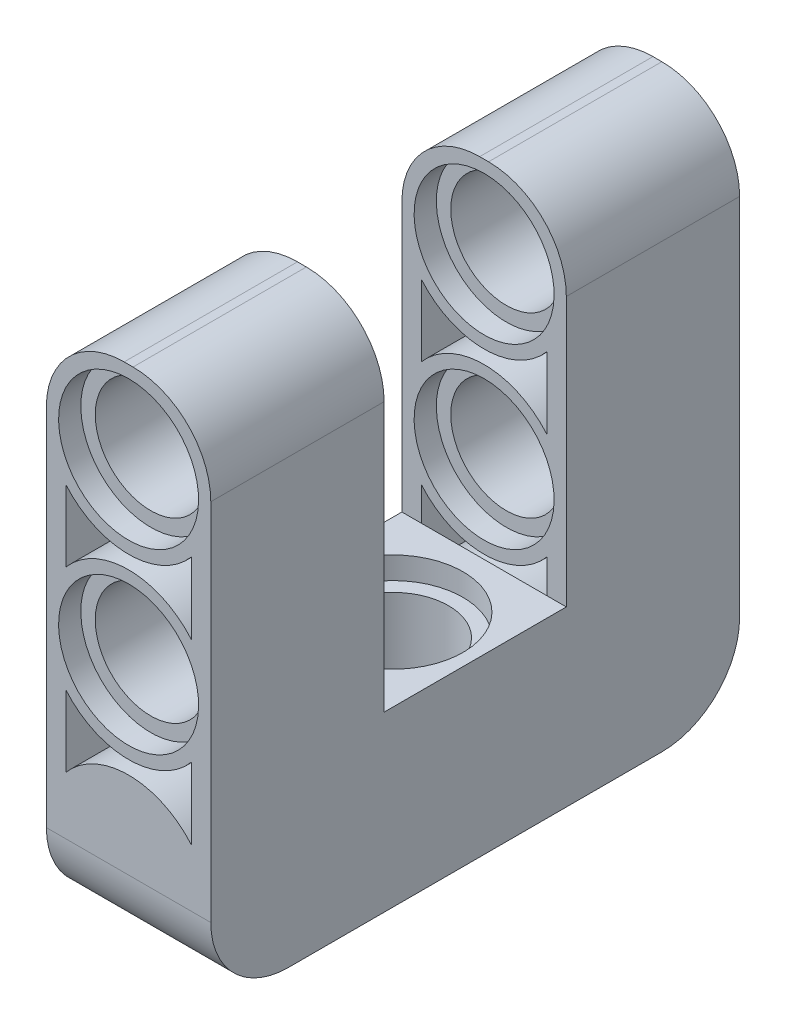
from build123d import *

# Parameters (mm, degrees)
SKETCH_3_W             = 7.8
SKETCH_3_H             = 23.4
SKETCH_3_W_2           = 8
SKETCH_3_H_2           = 7.8
SKETCH_3_W_3           = 0.1
EXTRUDE_1_DEPTH        = 7.4
CUT_EXTRUDE_1_REACH    = 22.97
SKETCH_4_R             = 2.5
SKETCH_4_3_R           = 3.15
SKETCH_4_3_R_2         = 2.5
CUT_EXTRUDE_2_DEPTH    = 1
CUT_EXTRUDE_START      = -6.8
SKETCH_4_4_R           = 3.15
SKETCH_4_4_R_2         = 2.5
CUT_EXTRUDE_3_DEPTH    = 1
SKETCH_5_R             = 2.5
CUT_EXTRUDE_4_DEPTH    = 35.187132082
SKETCH_5_3_R           = 3.15
SKETCH_5_3_R_2         = 2.5
CUT_EXTRUDE_5_DEPTH    = 1
SKETCH_5_4_R           = 3.15
SKETCH_5_4_R_2         = 2.5
CUT_EXTRUDE_6_DEPTH    = 1
CUT_EXTRUDE_START_2    = -16
SKETCH_5_5_R           = 3.15
SKETCH_5_5_R_2         = 2.5
CUT_EXTRUDE_7_DEPTH    = 1
CUT_EXTRUDE_START_3    = -22.8
SKETCH_5_6_R           = 3.15
SKETCH_5_6_R_2         = 2.5
CUT_EXTRUDE_8_DEPTH    = 1
PATTERN_LINEAR_1_COUNT = 2
PATTERN_LINEAR_1_PITCH = 8
CUT_EXTRUDE_9_DEPTH    = 2
CUT_EXTRUDE_START_4    = -5.8
CUT_EXTRUDE_10_DEPTH   = 2
CUT_EXTRUDE_11_DEPTH   = 2
CUT_EXTRUDE_START_5    = -21.8
CUT_EXTRUDE_12_DEPTH   = 2
PATTERN_LINEAR_2_COUNT = 2
PATTERN_LINEAR_2_PITCH = 8
FILLET_1_R             = 3.5


with BuildPart() as part:
    # 草图3 → 凸台-拉伸1 (new body)
    with BuildSketch(Plane(origin=(0, 0, 0), x_dir=(0, 0, -1), z_dir=(1, 0, 0))):
        with Locations((-8, 11.7)):
            Rectangle(SKETCH_3_W, SKETCH_3_H)
        with Locations((8, 11.7)):
            Rectangle(SKETCH_3_W, SKETCH_3_H)
        with Locations((0, 3.9)):
            Rectangle(SKETCH_3_W_2, SKETCH_3_H_2)
        with Locations((-4.05, 3.9)):
            Rectangle(SKETCH_3_W_3, SKETCH_3_H_2)
        with Locations((4.05, 3.9)):
            Rectangle(SKETCH_3_W_3, SKETCH_3_H_2)
    extrude(amount=EXTRUDE_1_DEPTH)

    # 草图4 → 切除-拉伸1 (cut, up to next)
    with BuildSketch(Plane(origin=(0, 7.8, 0), x_dir=(1, 0, 0), z_dir=(0, 1, 0)), mode=Mode.PRIVATE) as cut_extrude_1_sk1:
        with Locations(Location((3.7, 0, 0), (0, 0, 270))):
            Circle(SKETCH_4_R)
    cut_extrude_1_tool1 = extrude(cut_extrude_1_sk1.sketch, amount=-CUT_EXTRUDE_1_REACH, mode=Mode.PRIVATE) & part.part
    add(cut_extrude_1_tool1.solids().sort_by_distance((3.7, 7.8, 0))[0], mode=Mode.SUBTRACT)

    # 草图4<3> → 切除-拉伸2 (cut)
    with BuildSketch(Plane(origin=(0, 7.8, 0), x_dir=(1, 0, 0), z_dir=(0, 1, 0))):
        with Locations(Location((3.7, 0, 0), (0, 0, 270))):
            Circle(SKETCH_4_3_R)
        with Locations(Location((3.7, 0, 0), (0, 0, 270))):
            Circle(SKETCH_4_3_R_2, mode=Mode.SUBTRACT)
    extrude(amount=-CUT_EXTRUDE_2_DEPTH, mode=Mode.SUBTRACT)

    # 草图4<4> → 切除-拉伸3 (cut)
    with BuildSketch(Plane(origin=(0, 7.8, 0), x_dir=(1, 0, 0), z_dir=(0, 1, 0)).offset(CUT_EXTRUDE_START)):
        with Locations(Location((3.7, 0, 0), (0, 0, 270))):
            Circle(SKETCH_4_4_R)
        with Locations(Location((3.7, 0, 0), (0, 0, 270))):
            Circle(SKETCH_4_4_R_2, mode=Mode.SUBTRACT)
    extrude(amount=-CUT_EXTRUDE_3_DEPTH, mode=Mode.SUBTRACT)

    # 草图5 → 切除-拉伸4 (cut, through all)
    with BuildSketch(Plane(origin=(0, 0, -11.9), x_dir=(-1, 0, 0), z_dir=(0, 0, -1))):
        with Locations((-3.7, 11.7)):
            Circle(SKETCH_5_R)
    cut_extrude_4 = extrude(amount=-CUT_EXTRUDE_4_DEPTH, mode=Mode.SUBTRACT)

    # 草图5<3> → 切除-拉伸5 (cut)
    with BuildSketch(Plane(origin=(0, 0, -11.9), x_dir=(-1, 0, 0), z_dir=(0, 0, -1))):
        with Locations((-3.7, 11.7)):
            Circle(SKETCH_5_3_R)
        with Locations((-3.7, 11.7)):
            Circle(SKETCH_5_3_R_2, mode=Mode.SUBTRACT)
    cut_extrude_5 = extrude(amount=-CUT_EXTRUDE_5_DEPTH, mode=Mode.SUBTRACT)

    # 草图5<4> → 切除-拉伸6 (cut)
    with BuildSketch(Plane(origin=(0, 0, -11.9), x_dir=(-1, 0, 0), z_dir=(0, 0, -1)).offset(CUT_EXTRUDE_START)):
        with Locations((-3.7, 11.7)):
            Circle(SKETCH_5_4_R)
        with Locations((-3.7, 11.7)):
            Circle(SKETCH_5_4_R_2, mode=Mode.SUBTRACT)
    cut_extrude_6 = extrude(amount=-CUT_EXTRUDE_6_DEPTH, mode=Mode.SUBTRACT)

    # 草图5<5> → 切除-拉伸7 (cut)
    with BuildSketch(Plane(origin=(0, 0, -11.9), x_dir=(-1, 0, 0), z_dir=(0, 0, -1)).offset(CUT_EXTRUDE_START_2)):
        with Locations((-3.7, 11.7)):
            Circle(SKETCH_5_5_R)
        with Locations((-3.7, 11.7)):
            Circle(SKETCH_5_5_R_2, mode=Mode.SUBTRACT)
    cut_extrude_7 = extrude(amount=-CUT_EXTRUDE_7_DEPTH, mode=Mode.SUBTRACT)

    # 草图5<6> → 切除-拉伸8 (cut)
    with BuildSketch(Plane(origin=(0, 0, -11.9), x_dir=(-1, 0, 0), z_dir=(0, 0, -1)).offset(CUT_EXTRUDE_START_3)):
        with Locations((-3.7, 11.7)):
            Circle(SKETCH_5_6_R)
        with Locations((-3.7, 11.7)):
            Circle(SKETCH_5_6_R_2, mode=Mode.SUBTRACT)
    cut_extrude_8 = extrude(amount=-CUT_EXTRUDE_8_DEPTH, mode=Mode.SUBTRACT)

    # 阵列(线性)1: 切除-拉伸4, 切除-拉伸5, 切除-拉伸6, 切除-拉伸7, 切除-拉伸8 ×2
    with Locations(*[(0, i * PATTERN_LINEAR_1_PITCH, 0) for i in range(1, PATTERN_LINEAR_1_COUNT)]):
        add(cut_extrude_4, mode=Mode.SUBTRACT)
        add(cut_extrude_5, mode=Mode.SUBTRACT)
        add(cut_extrude_6, mode=Mode.SUBTRACT)
        add(cut_extrude_7, mode=Mode.SUBTRACT)
        add(cut_extrude_8, mode=Mode.SUBTRACT)

    # 草图6 → 切除-拉伸9 (cut)
    with BuildSketch(Plane(origin=(0, 0, -11.9), x_dir=(-1, 0, 0), z_dir=(0, 0, -1))):
        with BuildLine():
            ThreePointArc((-6.525, 14.089429848), (-3.7, 15.4), (-0.875, 14.089429848))
            Line((-0.875, 14.089429848), (-0.875, 17.310570152))
            ThreePointArc((-0.875, 17.310570152), (-3.7, 16), (-6.525, 17.310570152))
            Line((-6.525, 17.310570152), (-6.525, 14.089429848))
        make_face()
    cut_extrude_9 = extrude(amount=-CUT_EXTRUDE_9_DEPTH, mode=Mode.SUBTRACT)

    # 草图6<3> → 切除-拉伸10 (cut)
    with BuildSketch(Plane(origin=(0, 0, -11.9), x_dir=(-1, 0, 0), z_dir=(0, 0, -1)).offset(CUT_EXTRUDE_START_4)):
        with BuildLine():
            ThreePointArc((-6.525, 14.089429848), (-3.7, 15.4), (-0.875, 14.089429848))
            Line((-0.875, 14.089429848), (-0.875, 17.310570152))
            ThreePointArc((-0.875, 17.310570152), (-3.7, 16), (-6.525, 17.310570152))
            Line((-6.525, 17.310570152), (-6.525, 14.089429848))
        make_face()
    cut_extrude_10 = extrude(amount=-CUT_EXTRUDE_10_DEPTH, mode=Mode.SUBTRACT)

    # 草图6<4> → 切除-拉伸11 (cut)
    with BuildSketch(Plane(origin=(0, 0, -11.9), x_dir=(-1, 0, 0), z_dir=(0, 0, -1)).offset(CUT_EXTRUDE_START_2)):
        with BuildLine():
            ThreePointArc((-6.525, 14.089429848), (-3.7, 15.4), (-0.875, 14.089429848))
            Line((-0.875, 14.089429848), (-0.875, 17.310570152))
            ThreePointArc((-0.875, 17.310570152), (-3.7, 16), (-6.525, 17.310570152))
            Line((-6.525, 17.310570152), (-6.525, 14.089429848))
        make_face()
    cut_extrude_11 = extrude(amount=-CUT_EXTRUDE_11_DEPTH, mode=Mode.SUBTRACT)

    # 草图6<5> → 切除-拉伸12 (cut)
    with BuildSketch(Plane(origin=(0, 0, -11.9), x_dir=(-1, 0, 0), z_dir=(0, 0, -1)).offset(CUT_EXTRUDE_START_5)):
        with BuildLine():
            ThreePointArc((-6.525, 14.089429848), (-3.7, 15.4), (-0.875, 14.089429848))
            Line((-0.875, 14.089429848), (-0.875, 17.310570152))
            ThreePointArc((-0.875, 17.310570152), (-3.7, 16), (-6.525, 17.310570152))
            Line((-6.525, 17.310570152), (-6.525, 14.089429848))
        make_face()
    cut_extrude_12 = extrude(amount=-CUT_EXTRUDE_12_DEPTH, mode=Mode.SUBTRACT)

    # 阵列(线性)2: 切除-拉伸9, 切除-拉伸10, 切除-拉伸11, 切除-拉伸12 ×2
    with Locations(*[(0, -i * PATTERN_LINEAR_2_PITCH, 0) for i in range(1, PATTERN_LINEAR_2_COUNT)]):
        add(cut_extrude_9, mode=Mode.SUBTRACT)
        add(cut_extrude_10, mode=Mode.SUBTRACT)
        add(cut_extrude_11, mode=Mode.SUBTRACT)
        add(cut_extrude_12, mode=Mode.SUBTRACT)

    # 圆角1
    fillet_1_edges = [part.edges().sort_by_distance(p)[0] for p in [
        (7.4, 23.4, -8),
        (0, 23.4, 8),
        (0, 23.4, -8),
        (3.7, 0, -11.9),
        (3.7, 0, 11.9),
        (7.4, 23.4, 8),
    ]]
    fillet(fillet_1_edges, radius=FILLET_1_R)


solid = part.part
